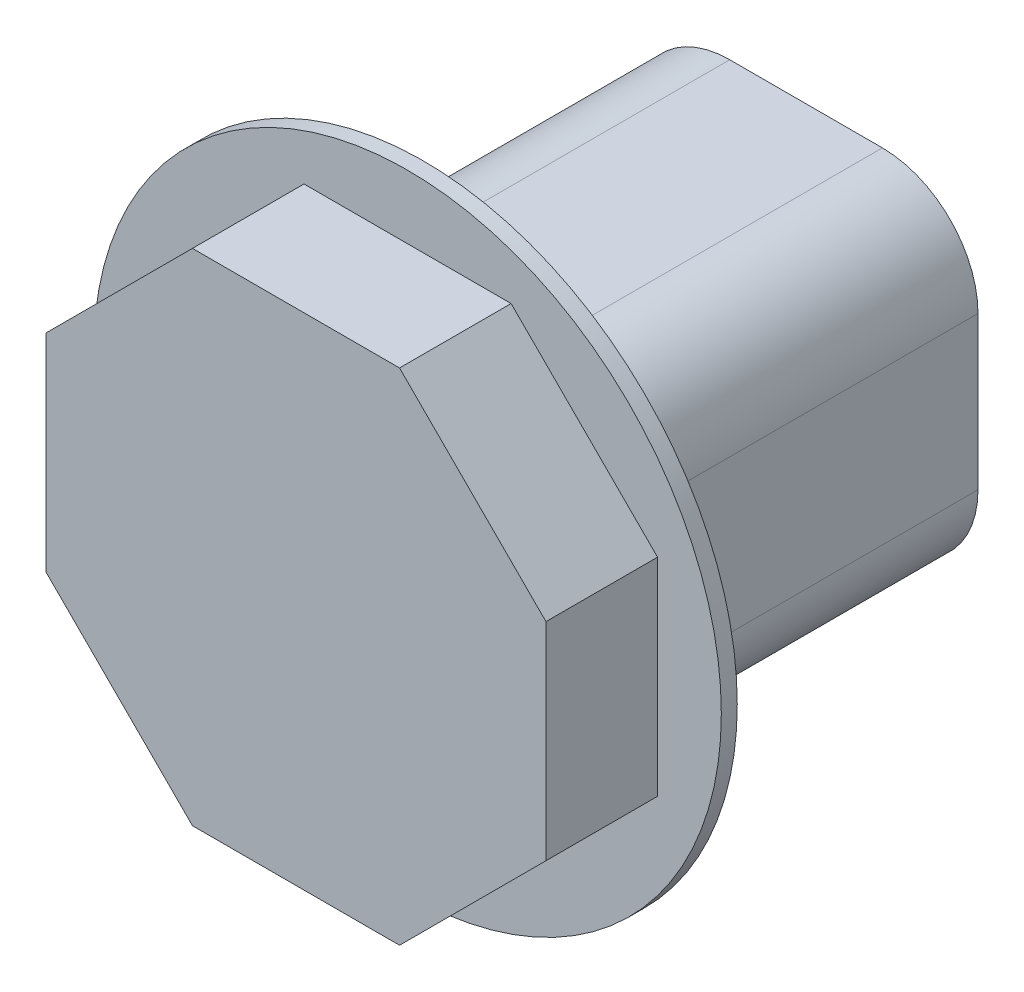
from build123d import *

# Parameters (mm, degrees)
BOSS_EXTRUDE1_DEPTH = 203.2
SKETCH1_3_R         = 500
BOSS_EXTRUDE2_DEPTH = 25.4
SKETCH2_W           = 548.008149558
SKETCH2_H           = 548.008149558
BOSS_EXTRUDE3_DEPTH = 609.6
FILLET1_R           = 152.4


with BuildPart() as part:
    # Sketch1 → Boss-Extrude1 (new body)
    with BuildSketch(Plane.XY):
        Polygon((398.358671467, -165.005564411), (398.358671467, 165.005564411), (165.005564411, 398.358671467), (-165.005564411, 398.358671467), (-398.358671467, 165.005564411), (-398.358671467, -165.005564411), (-165.005564411, -398.358671467), (165.005564411, -398.358671467), align=None)
    extrude(amount=BOSS_EXTRUDE1_DEPTH)

    # Sketch1<3> → Boss-Extrude2 (add)
    with BuildSketch(Plane.XY):
        Circle(SKETCH1_3_R)
        Polygon((165.005564411, 398.358671467), (-165.005564411, 398.358671467), (-398.358671467, 165.005564411), (-398.358671467, -165.005564411), (-165.005564411, -398.358671467), (165.005564411, -398.358671467), (398.358671467, -165.005564411), (398.358671467, 165.005564411), align=None, mode=Mode.SUBTRACT)
    extrude(amount=BOSS_EXTRUDE2_DEPTH)


with BuildPart() as body_2:
    # Sketch2 → Boss-Extrude3 (new body)
    with BuildSketch(Plane(origin=(0, 0, 0), x_dir=(-1, 0, 0), z_dir=(0, 0, -1))):
        Rectangle(SKETCH2_W, SKETCH2_H)
    extrude(amount=BOSS_EXTRUDE3_DEPTH)

    # Fillet1
    fillet1_edges = [body_2.edges().sort_by_distance(p)[0] for p in [
        (274.004074779, 274.004074779, -304.8),
        (-274.004074779, 274.004074779, -304.8),
        (-274.004074779, -274.004074779, -304.8),
        (274.004074779, -274.004074779, -304.8),
    ]]
    fillet(fillet1_edges, radius=FILLET1_R)


solid = Compound([part.part, body_2.part])
